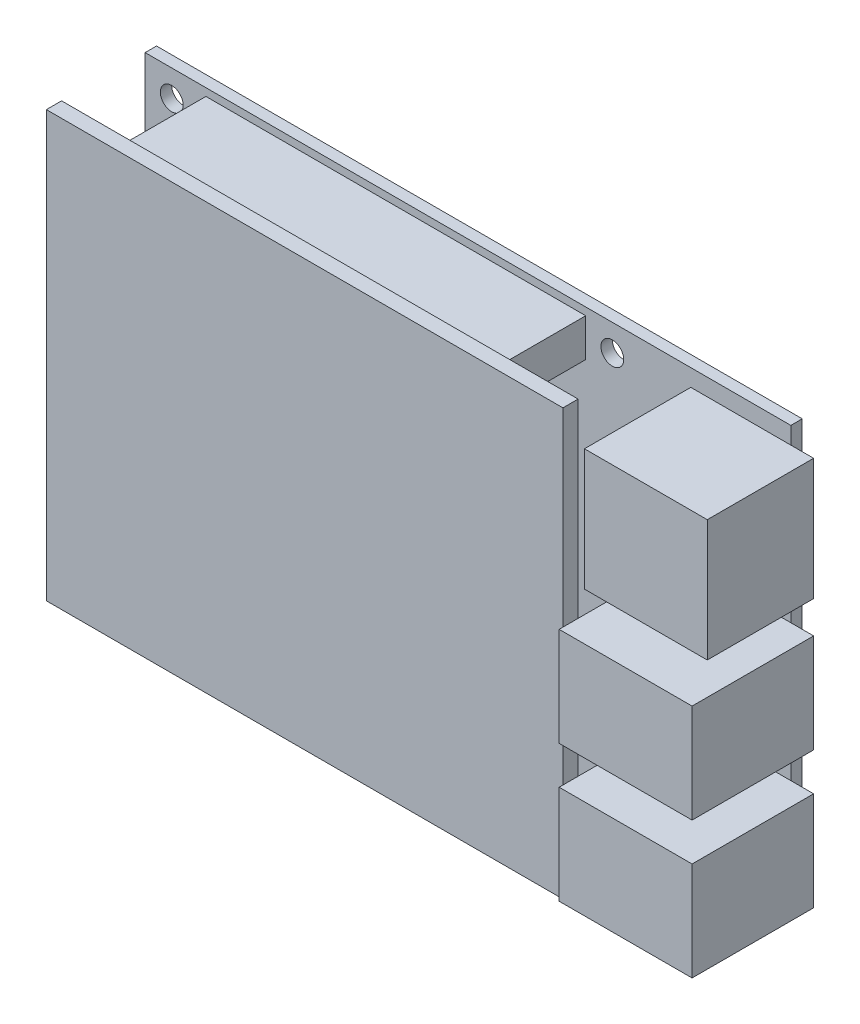
from build123d import *

# Parameters (mm, degrees)
SKETCH1_W           = 85
SKETCH1_H           = 56
BOSS_EXTRUDE1_DEPTH = 1.5
SKETCH2_R           = 1.5
CUT_EXTRUDE1_DEPTH  = 102.800049116
SKETCH3_W           = 17.5
SKETCH3_H           = 13
BOSS_EXTRUDE3_DEPTH = 16
SKETCH4_W           = 16.168614458
SKETCH4_H           = 16
BOSS_EXTRUDE4_DEPTH = 14
SKETCH5_W           = 50
SKETCH5_H           = 5
BOSS_EXTRUDE5_DEPTH = 11
SKETCH6_W           = 68
SKETCH6_H           = 56
BOSS_EXTRUDE6_DEPTH = 2


with BuildPart() as part:
    # Sketch1 → Boss-Extrude1 (new body)
    with BuildSketch(Plane.XY):
        with Locations((42.5, 28)):
            Rectangle(SKETCH1_W, SKETCH1_H)
    extrude(amount=BOSS_EXTRUDE1_DEPTH)

    # Sketch2 → Cut-Extrude1 (cut, through all)
    with BuildSketch(Plane.XY.offset(1.5)):
        with Locations((3.5, 52.5)):
            Circle(SKETCH2_R)
        with Locations((3.5, 3.5)):
            Circle(SKETCH2_R)
        with Locations((61.5, 52.5)):
            Circle(SKETCH2_R)
        with Locations((61.5, 3.5)):
            Circle(SKETCH2_R)
    extrude(amount=-CUT_EXTRUDE1_DEPTH, mode=Mode.SUBTRACT)

    # Sketch3 → Boss-Extrude3 (add)
    with BuildSketch(Plane.XY.offset(1.5)):
        with Locations((79.25, 9)):
            Rectangle(SKETCH3_W, SKETCH3_H)
        with Locations((79.25, 27)):
            Rectangle(SKETCH3_W, SKETCH3_H)
    extrude(amount=BOSS_EXTRUDE3_DEPTH)

    # Sketch4 → Boss-Extrude4 (add)
    with BuildSketch(Plane.XY.offset(1.5)):
        with Locations((79.915692771, 45.75)):
            Rectangle(SKETCH4_W, SKETCH4_H)
    extrude(amount=BOSS_EXTRUDE4_DEPTH)

    # Sketch5 → Boss-Extrude5 (add)
    with BuildSketch(Plane.XY.offset(1.5)):
        with Locations((33, 52.5)):
            Rectangle(SKETCH5_W, SKETCH5_H)
    extrude(amount=BOSS_EXTRUDE5_DEPTH)

    # Sketch6 → Boss-Extrude6 (add)
    with BuildSketch(Plane.XY.offset(12.5)):
        with Locations((34, 28)):
            Rectangle(SKETCH6_W, SKETCH6_H)
    extrude(amount=BOSS_EXTRUDE6_DEPTH)


solid = part.part
